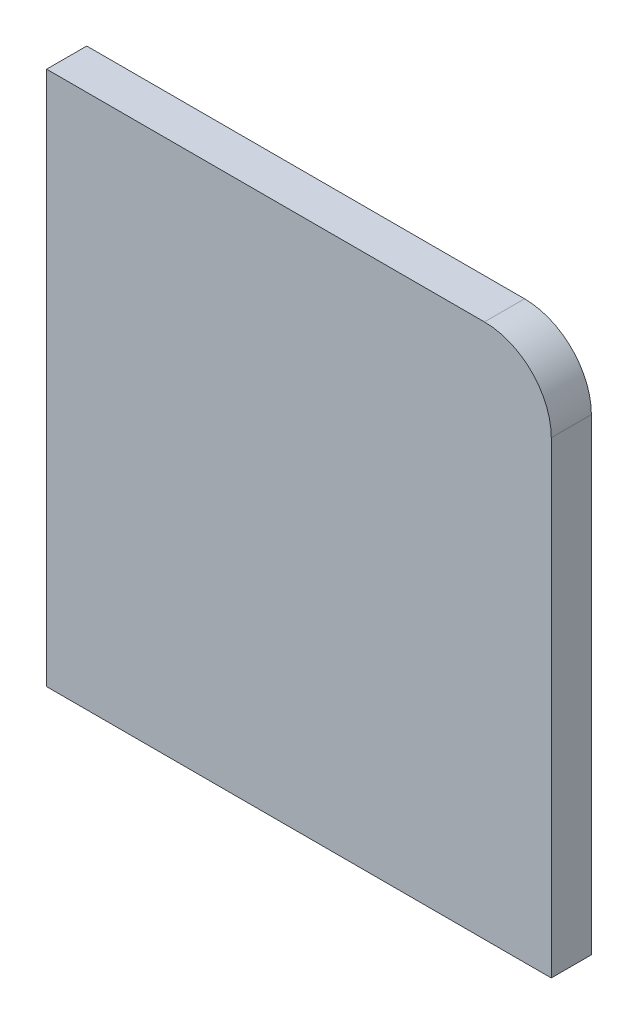
from build123d import *

# Parameters (mm, degrees)
ESQUISSE1_W      = 75.5
ESQUISSE1_H      = 80
EXTRUSION1_DEPTH = 6
CONG_1_R         = 10


with BuildPart() as part:
    # Esquisse1 → Extrusion1 (new body)
    with BuildSketch(Plane.XY):
        with Locations((7.75, 10)):
            Rectangle(ESQUISSE1_W, ESQUISSE1_H)
    extrude(amount=EXTRUSION1_DEPTH)

    # Congé1
    cong_1_edges = [part.edges().sort_by_distance(p)[0] for p in [
        (45.5, 50, 3),
    ]]
    fillet(cong_1_edges, radius=CONG_1_R)


solid = part.part
